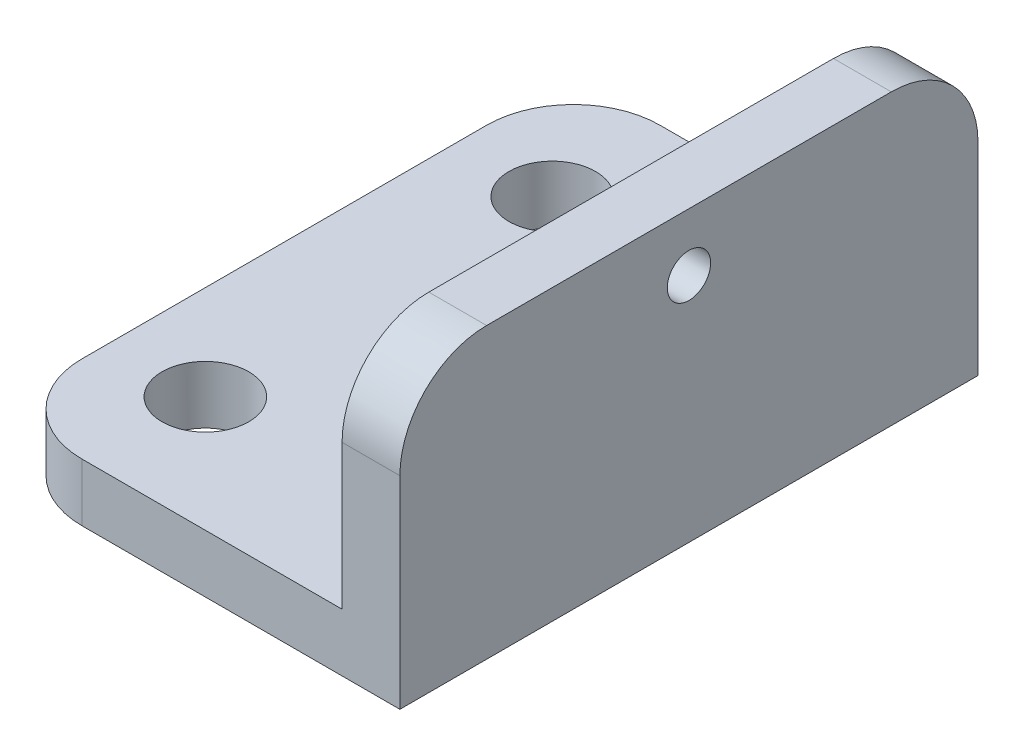
from build123d import *

# Parameters (mm, degrees)
EXTRUDE_THIN1_DEPTH = 10
FILLET2_R           = 3
SKETCH2_R           = 1.5
CUT_EXTRUDE1_DEPTH  = 10
SKETCH3_R           = 0.75
CUT_EXTRUDE2_DEPTH  = 10


with BuildPart() as part:
    # Sketch1 → Extrude-Thin1 (new, symmetric)
    with BuildSketch(Plane.XY):
        Polygon((0, 8), (0, 0), (-12, 0), (-12, -2), (2, -2), (2, 8), align=None)
    extrude(amount=EXTRUDE_THIN1_DEPTH, both=True)

    # Fillet2
    fillet2_edges = [part.edges().sort_by_distance(p)[0] for p in [
        (-12, -1, 10),
        (-12, -1, -10),
        (1, 8, -10),
        (1, 8, 10),
    ]]
    fillet(fillet2_edges, radius=FILLET2_R)

    # Sketch2 → Cut-Extrude1 (cut)
    with BuildSketch(Plane(origin=(0, 0, 0), x_dir=(1, 0, 0), z_dir=(0, 1, 0))):
        with Locations(Location((-8.729026119, 6, 0), (0, 0, 180))):
            Circle(SKETCH2_R)
        with Locations(Location((-8.729026119, -6, 0), (0, 0, 180))):
            Circle(SKETCH2_R)
    extrude(amount=-CUT_EXTRUDE1_DEPTH, mode=Mode.SUBTRACT)

    # Sketch3 → Cut-Extrude2 (cut)
    with BuildSketch(Plane.ZY):
        with Locations((0, 6)):
            Circle(SKETCH3_R)
    extrude(amount=-CUT_EXTRUDE2_DEPTH, mode=Mode.SUBTRACT)


solid = part.part
